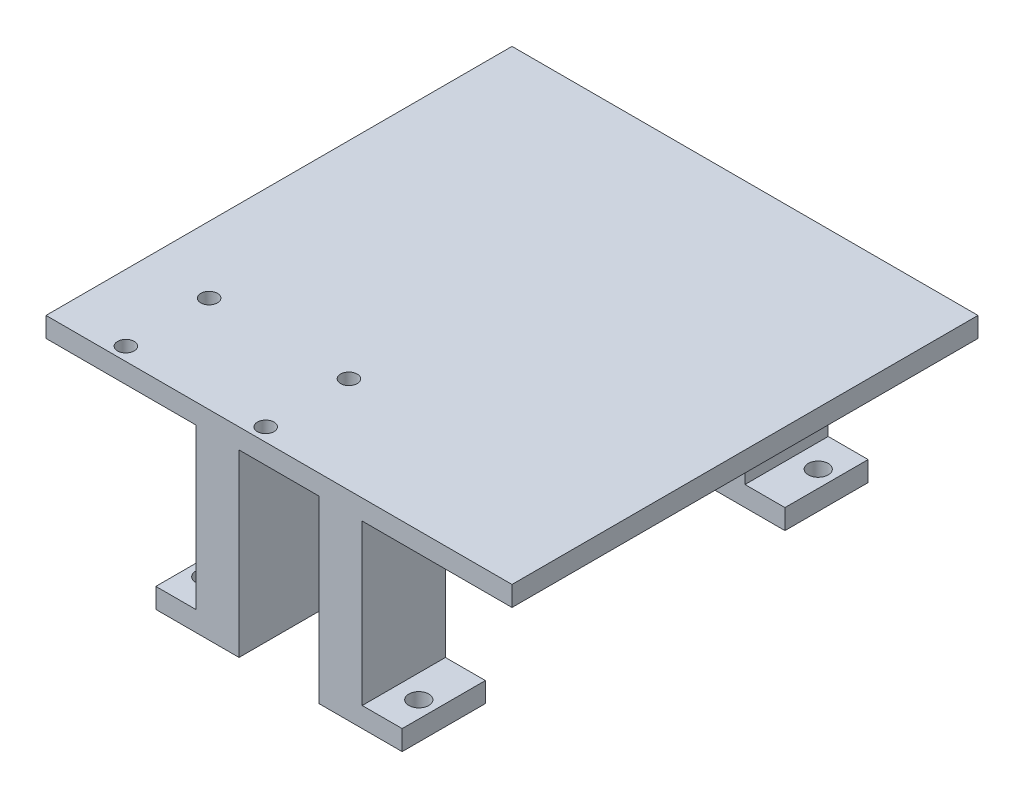
from build123d import *

# Parameters (mm, degrees)
EXTRUDE_1_DEPTH     = 35
SKETCH_2_W          = 45
SKETCH_2_H          = 27
CUT_EXTRUDE_1_DEPTH = 35
SKETCH_3_W          = 12
SKETCH_3_H          = 27
CUT_EXTRUDE_2_DEPTH = 40
SKETCH_4_R          = 1.5
CUT_EXTRUDE_3_DEPTH = 19
SKETCH_5_R          = 1.25
CUT_EXTRUDE_4_DEPTH = 5


with BuildPart() as part:
    # 草圖1 → 填料-伸長1 (new, symmetric)
    with BuildSketch(Plane.XY):
        Polygon((-18.5, 0), (-18.5, 3), (-12.5, 3), (-12.5, 27), (-35, 27), (-35, 30), (35, 30), (35, 27), (12.5, 27), (12.5, 3), (18.5, 3), (18.5, 0), align=None)
    extrude(amount=EXTRUDE_1_DEPTH, both=True)

    # 草圖2 → 除料-伸長1 (cut, symmetric)
    with BuildSketch(Plane(origin=(0, 0, 0), x_dir=(0, 0, -1), z_dir=(1, 0, 0))):
        with Locations((0, 13.5)):
            Rectangle(SKETCH_2_W, SKETCH_2_H)
    extrude(amount=CUT_EXTRUDE_1_DEPTH, both=True, mode=Mode.SUBTRACT)

    # 草圖3 → 除料-伸長2 (cut, symmetric)
    with BuildSketch(Plane.XY):
        with Locations((0, 13.5)):
            Rectangle(SKETCH_3_W, SKETCH_3_H)
    extrude(amount=CUT_EXTRUDE_2_DEPTH, both=True, mode=Mode.SUBTRACT)

    # 草圖4 → 除料-伸長3 (cut)
    with BuildSketch(Plane(origin=(0, 0, 0), x_dir=(1, 0, 0), z_dir=(0, 1, 0))):
        with Locations(Location((-16, -30, 0), (0, 0, 90))):
            Circle(SKETCH_4_R)
        with Locations(Location((16, -30, 0), (0, 0, 90))):
            Circle(SKETCH_4_R)
        with Locations(Location((16, 30, 0), (0, 0, 90))):
            Circle(SKETCH_4_R)
        with Locations(Location((-16, 30, 0), (0, 0, 90))):
            Circle(SKETCH_4_R)
    extrude(amount=CUT_EXTRUDE_3_DEPTH, mode=Mode.SUBTRACT)

    # 草圖5 → 除料-伸長4 (cut, symmetric)
    with BuildSketch(Plane(origin=(0, 30, 0), x_dir=(1, 0, 0), z_dir=(0, 1, 0))):
        with Locations(Location((-4, -20.5, 0), (0, 0, 180))):
            Circle(SKETCH_5_R)
        with Locations(Location((-4, -33, 0), (0, 0, 180))):
            Circle(SKETCH_5_R)
        with Locations(Location((-25, -33, 0), (0, 0, 180))):
            Circle(SKETCH_5_R)
        with Locations(Location((-25, -20.5, 0), (0, 0, 180))):
            Circle(SKETCH_5_R)
    extrude(amount=CUT_EXTRUDE_4_DEPTH, both=True, mode=Mode.SUBTRACT)


solid = part.part
